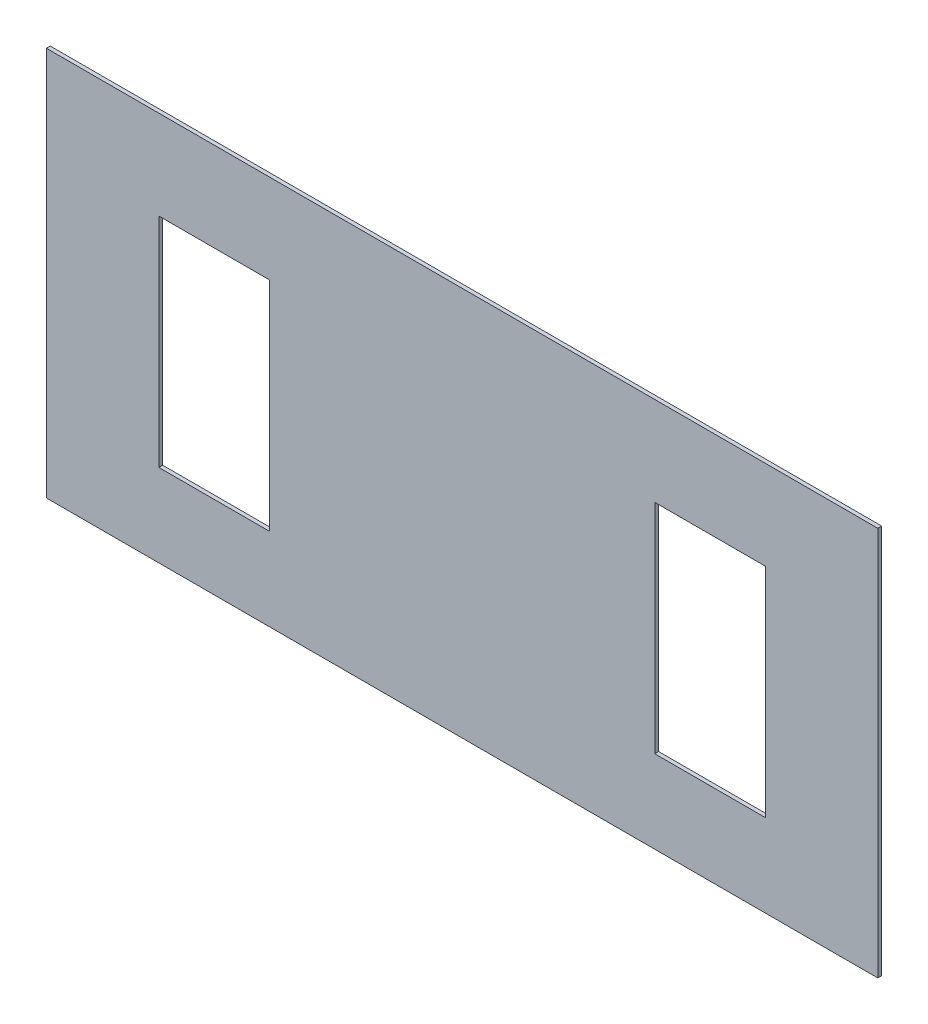
from build123d import *

# Parameters (mm, degrees)
SKETCH1_W           = 434
SKETCH1_H           = 203.336989564
BOSS_EXTRUDE1_DEPTH = 2
SKETCH2_W           = 57.723013192
SKETCH2_H           = 113.65363529
CUT_EXTRUDE1_DEPTH  = 435.934085853


with BuildPart() as part:
    # Sketch1 → Boss-Extrude1 (new body)
    with BuildSketch(Plane.XY):
        with Locations((205.475, 1.668494782)):
            Rectangle(SKETCH1_W, SKETCH1_H)
    extrude(amount=BOSS_EXTRUDE1_DEPTH)

    # Sketch2 → Cut-Extrude1 (cut, through all)
    with BuildSketch(Plane.XY.offset(2)):
        with Locations((76.025, 0)):
            Rectangle(SKETCH2_W, SKETCH2_H)
        with Locations((334.925, 0)):
            Rectangle(SKETCH2_W, SKETCH2_H)
    extrude(amount=-CUT_EXTRUDE1_DEPTH, mode=Mode.SUBTRACT)


solid = part.part
